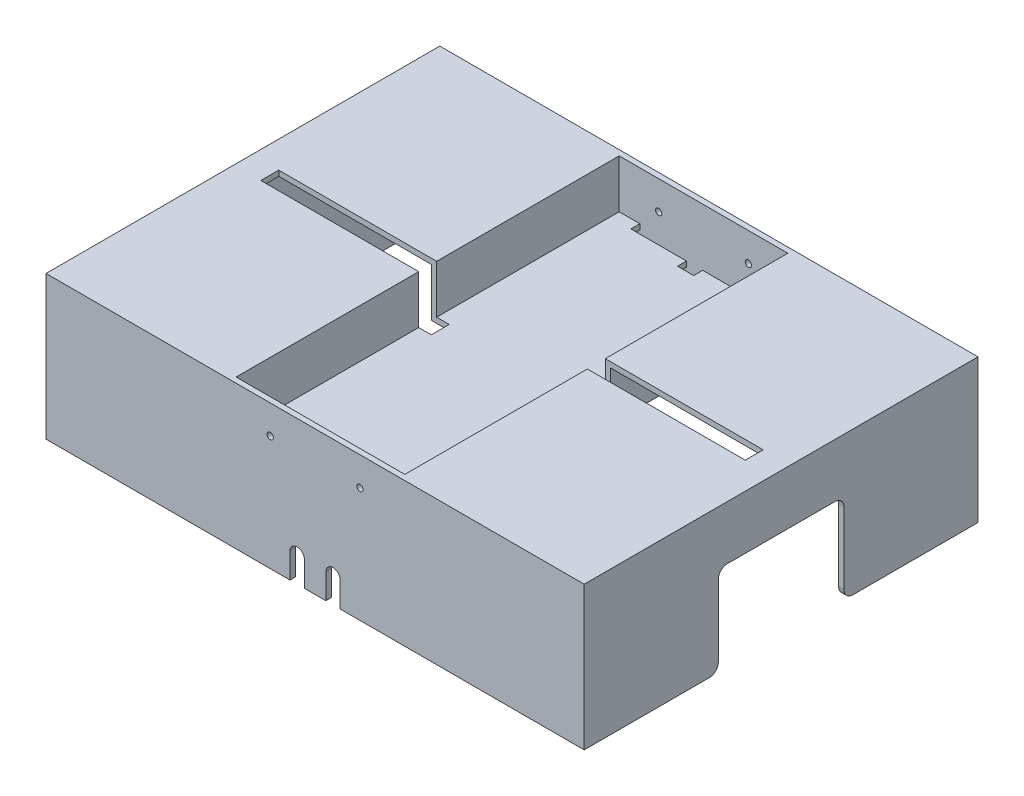
from build123d import *

# Parameters (mm, degrees)
SKETCH1_W             = 100
SKETCH1_H             = 213.5
BOSS_EXTRUDE1_DEPTH   = 3
BOSS_EXTRUDE1_2_DEPTH = 3
SKETCH2_W             = 300
SKETCH2_H             = 80
BOSS_EXTRUDE2_DEPTH   = 3
SKETCH4_W             = 3
SKETCH4_H             = 213.5
BOSS_EXTRUDE4_DEPTH   = 30
SKETCH5_W             = 94
SKETCH5_H             = 213.5
BOSS_EXTRUDE5_DEPTH   = 3
CUT_EXTRUDE2_REACH    = 195.272
CUT_EXTRUDE1_REACH    = 204.349
SKETCH3_W             = 95
SKETCH3_H             = 10
SKETCH7_W             = 213.5
SKETCH7_H             = 77
BOSS_EXTRUDE6_DEPTH   = 3
SKETCH8_R             = 1.75
CUT_EXTRUDE3_DEPTH    = 277.783760362
CUT_EXTRUDE4_REACH    = 330.594
FILLET1_R             = 5


with BuildPart() as part:
    # Sketch1 → Boss-Extrude1 (new body)
    with BuildSketch(Plane(origin=(0, 0, 0), x_dir=(1, 0, 0), z_dir=(0, 1, 0))):
        with Locations((-100, 0)):
            Rectangle(SKETCH1_W, SKETCH1_H)
    extrude(amount=BOSS_EXTRUDE1_DEPTH)



with BuildPart() as body_2:
    # Sketch1 → Boss-Extrude1 2 (new body)
    with BuildSketch(Plane(origin=(0, 0, 0), x_dir=(1, 0, 0), z_dir=(0, 1, 0))):
        with Locations((100, 0)):
            Rectangle(SKETCH1_W, SKETCH1_H)
    extrude(amount=BOSS_EXTRUDE1_2_DEPTH)


with BuildPart() as part_1:
    add(part.part)

    add(body_2.part)  # Boss-Extrude2 merges body 2
    # Sketch2 → Boss-Extrude2 (add)
    with BuildSketch(Plane.XY.offset(106.75)):
        with Locations((0, -37)):
            Rectangle(SKETCH2_W, SKETCH2_H)
    boss_extrude2 = extrude(amount=BOSS_EXTRUDE2_DEPTH)

    # Mirror1: Boss-Extrude2 across plane
    add(boss_extrude2.mirror(Plane.XY))

    # Sketch4 → Boss-Extrude4 (add)
    with BuildSketch(Plane(origin=(0, 3, 0), x_dir=(1, 0, 0), z_dir=(0, 1, 0))):
        with Locations((-48.5, 0)):
            Rectangle(SKETCH4_W, SKETCH4_H)
        with Locations((48.5, 0)):
            Rectangle(SKETCH4_W, SKETCH4_H)
    extrude(amount=-BOSS_EXTRUDE4_DEPTH)

    # Sketch5 → Boss-Extrude5 (add)
    with BuildSketch(Plane.XZ.offset(27)):
        Rectangle(SKETCH5_W, SKETCH5_H)
    extrude(amount=-BOSS_EXTRUDE5_DEPTH)

    # Sketch6 → Cut-Extrude2 (cut, up to next)
    with BuildSketch(Plane(origin=(0, -24, 0), x_dir=(1, 0, 0), z_dir=(0, 1, 0)), mode=Mode.PRIVATE) as cut_extrude2_sk1:
        Polygon((-35.5, 106.75), (35.5, 106.75), (35.5, 101.75), (4.5, 101.75), (4.5, 96.75), (-4.5, 96.75), (-4.5, 101.75), (-35.5, 101.75), align=None)
    cut_extrude2_tool1 = extrude(cut_extrude2_sk1.sketch, amount=-CUT_EXTRUDE2_REACH, mode=Mode.PRIVATE) & part_1.part
    # Sketch6 → Cut-Extrude2 (cut, up to next)
    with BuildSketch(Plane(origin=(0, -24, 0), x_dir=(1, 0, 0), z_dir=(0, 1, 0)), mode=Mode.PRIVATE) as cut_extrude2_sk2:
        Polygon((-35.5, -106.75), (35.5, -106.75), (35.5, -101.75), (4.5, -101.75), (4.5, -96.75), (-4.5, -96.75), (-4.5, -101.75), (-35.5, -101.75), align=None)
    cut_extrude2_tool2 = extrude(cut_extrude2_sk2.sketch, amount=-CUT_EXTRUDE2_REACH, mode=Mode.PRIVATE) & part_1.part
    add(cut_extrude2_tool1.solids().sort_by_distance((0, -24, -103.6875))[0], mode=Mode.SUBTRACT)
    add(cut_extrude2_tool2.solids().sort_by_distance((0, -24, 103.6875))[0], mode=Mode.SUBTRACT)

    # Sketch3 → Cut-Extrude1 (cut, up to next)
    with BuildSketch(Plane(origin=(0, 3, 0), x_dir=(1, 0, 0), z_dir=(0, 1, 0)), mode=Mode.PRIVATE) as cut_extrude1_sk1:
        with Locations((-87.5, 0)):
            Rectangle(SKETCH3_W, SKETCH3_H)
    cut_extrude1_tool1 = extrude(cut_extrude1_sk1.sketch, amount=-CUT_EXTRUDE1_REACH, mode=Mode.PRIVATE) & part_1.part
    # Sketch3 → Cut-Extrude1 (cut, up to next)
    with BuildSketch(Plane(origin=(0, 3, 0), x_dir=(1, 0, 0), z_dir=(0, 1, 0)), mode=Mode.PRIVATE) as cut_extrude1_sk2:
        with Locations((87.5, 0)):
            Rectangle(SKETCH3_W, SKETCH3_H)
    cut_extrude1_tool2 = extrude(cut_extrude1_sk2.sketch, amount=-CUT_EXTRUDE1_REACH, mode=Mode.PRIVATE) & part_1.part
    add(cut_extrude1_tool1.solids().sort_by_distance((-87.5, 3, 0))[0], mode=Mode.SUBTRACT)
    add(cut_extrude1_tool2.solids().sort_by_distance((87.5, 3, 0))[0], mode=Mode.SUBTRACT)

    # Sketch7 → Boss-Extrude6 (add)
    with BuildSketch(Plane.ZY.offset(150)):
        with Locations((0, -38.5)):
            Rectangle(SKETCH7_W, SKETCH7_H)
    boss_extrude6 = extrude(amount=-BOSS_EXTRUDE6_DEPTH)

    # Mirror2: Boss-Extrude6 across plane
    add(boss_extrude6.mirror(Plane(origin=(0, 0, 0), x_dir=(0, 0, 1), z_dir=(1, 0, 0))))

    # Sketch8 → Cut-Extrude3 (cut, through all)
    with BuildSketch(Plane.XY.offset(109.75)):
        with Locations((-25, -13)):
            Circle(SKETCH8_R)
        with Locations((25, -13)):
            Circle(SKETCH8_R)
        with BuildLine():
            Line((-14, -63), (-14, -77))
            Line((-14, -77), (-6, -77))
            Line((-6, -77), (-6, -63))
            ThreePointArc((-6, -63), (-10, -59), (-14, -63))
        make_face()
        with BuildLine():
            Line((14, -63), (14, -77))
            Line((14, -77), (6, -77))
            Line((6, -77), (6, -63))
            ThreePointArc((6, -63), (10, -59), (14, -63))
        make_face()
    extrude(amount=-CUT_EXTRUDE3_DEPTH, mode=Mode.SUBTRACT)

    # Sketch10 → Cut-Extrude4 (cut, up to next)
    with BuildSketch(Plane(origin=(150, 0, 0), x_dir=(0, 0, -1), z_dir=(1, 0, 0)), mode=Mode.PRIVATE) as cut_extrude4_sk1:
        with BuildLine():
            Line((-30, -27), (30, -27))
            ThreePointArc((30, -27), (33.535533906, -28.464466094), (35, -32))
            Line((35, -32), (35, -77))
            Line((35, -77), (-35, -77))
            Line((-35, -77), (-35, -32))
            ThreePointArc((-35, -32), (-33.535533906, -28.464466094), (-30, -27))
        make_face()
    cut_extrude4_tool1 = extrude(cut_extrude4_sk1.sketch, amount=-CUT_EXTRUDE4_REACH, mode=Mode.PRIVATE) & part_1.part
    add(cut_extrude4_tool1.solids().sort_by_distance((150, -52.073445, 0))[0], mode=Mode.SUBTRACT)

    # Fillet1
    fillet1_edges = [part_1.edges().sort_by_distance(p)[0] for p in [
        (148.5, -77, 35),
        (148.5, -77, -35),
    ]]
    fillet(fillet1_edges, radius=FILLET1_R)


solid = part_1.part
